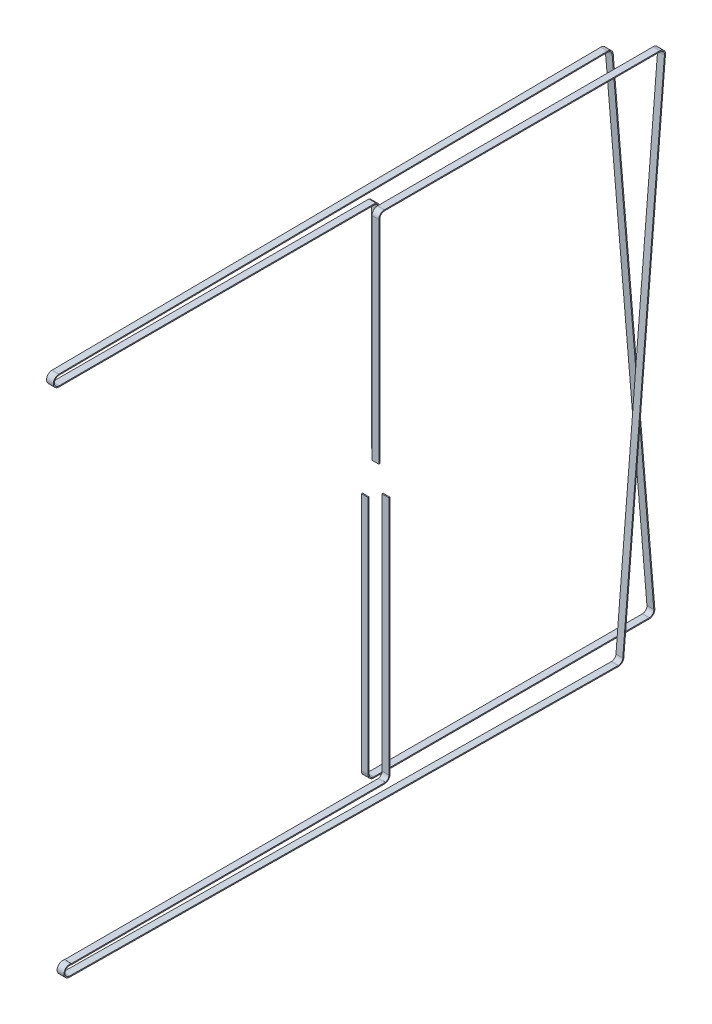
from build123d import *

# Parameters (mm, degrees)
EXTRUDE_START   = 1
EXTRUDE_1_DEPTH = 9
EXTRUDE_2_DEPTH = 9


with BuildPart() as part:
    # Эскиз1 → Вытянуть-Тонкостенный1 (new body)
    with BuildSketch(Plane(origin=(43, 0, 0), x_dir=(0, 0, -1), z_dir=(1, 0, 0)).offset(EXTRUDE_START)):
        with BuildLine():
            Line((-365.210954527, 391.088904873), (-365.210954527, 670))
            ThreePointArc((-365.210954527, 670), (-366.505742897, 674.181673224), (-369.937006136, 676.9))
            Line((-369.937006136, 676.9), (-787, 676.9))
            ThreePointArc((-787, 676.9), (-792.999927517, 682.870507794), (-787.0589837, 688.89971007))
            Line((-787.0589837, 688.89971007), (-64.860447413, 695.99971007))
            ThreePointArc((-64.860447413, 695.99971007), (-60.759896196, 694.434606184), (-58.822040574, 690.496486576))
            Line((-58.822040574, 690.496486576), (-4.020576861, 30.496486576))
            ThreePointArc((-4.020576861, 30.496486576), (-5.585313179, 25.936683587), (-10, 24))
            Line((-10, 24), (-372.610954527, 24))
            ThreePointArc((-372.610954527, 24), (-376.853595214, 25.757359313), (-378.610954527, 30))
            Line((-378.610954527, 30), (-378.610954527, 346.088904873))
            Line((-378.610954527, 346.088904873), (-380.010954527, 346.088904873))
            Line((-380.010954527, 346.088904873), (-380.010954527, 30))
            ThreePointArc((-380.010954527, 30), (-377.843544708, 24.767409819), (-372.610954527, 22.6))
            Line((-372.610954527, 22.6), (-10, 22.6))
            ThreePointArc((-10, 22.6), (-4.555219587, 24.988576424), (-2.625378128, 30.612333444))
            Line((-2.625378128, 30.612333444), (-57.426841842, 690.612333444))
            ThreePointArc((-57.426841842, 690.612333444), (-59.816863776, 695.469347626), (-64.874210276, 697.39964242))
            Line((-64.874210276, 697.39964242), (-787.072746563, 690.29964242))
            ThreePointArc((-787.072746563, 690.29964242), (-794.399910604, 682.863626279), (-787, 675.5))
            Line((-787, 675.5), (-370.213038765, 675.5))
            ThreePointArc((-370.213038765, 675.5), (-367.591617192, 673.287286528), (-366.610954527, 670))
            Line((-366.610954527, 670), (-366.610954527, 391.088904873))
            Line((-366.610954527, 391.088904873), (-365.210954527, 391.088904873))
        make_face()
    extrude(amount=EXTRUDE_1_DEPTH)


with BuildPart() as body_2:
    # Эскиз2 → Вытянуть-Тонкостенный2 (new body)
    with BuildSketch(Plane(origin=(57, 0, 0), x_dir=(0, 0, -1), z_dir=(1, 0, 0)).offset(EXTRUDE_START)):
        with BuildLine():
            Line((-365.210954527, 346.088904873), (-365.210954527, 30))
            ThreePointArc((-365.210954527, 30), (-366.937621008, 25.248864685), (-371.311842847, 22.714925612))
            Line((-371.311842847, 22.714925612), (-784.885145307, 22.714925612))
            ThreePointArc((-784.885145307, 22.714925612), (-792.897592042, 18.203815252), (-787.0589837, 11.10028993))
            Line((-787.0589837, 11.10028993), (-64.860447413, 4.00028993))
            ThreePointArc((-64.860447413, 4.00028993), (-60.759896196, 5.565393816), (-58.822040574, 9.503513424))
            Line((-58.822040574, 9.503513424), (-4.020576861, 669.503513424))
            ThreePointArc((-4.020576861, 669.503513424), (-5.585313179, 674.063316413), (-10, 676))
            Line((-10, 676), (-372.610954527, 676))
            ThreePointArc((-372.610954527, 676), (-376.853595214, 674.242640687), (-378.610954527, 670))
            Line((-378.610954527, 670), (-378.610954527, 391.088904873))
            Line((-378.610954527, 391.088904873), (-380.010954527, 391.088904873))
            Line((-380.010954527, 391.088904873), (-380.010954527, 670))
            ThreePointArc((-380.010954527, 670), (-377.843544708, 675.232590181), (-372.610954527, 677.4))
            Line((-372.610954527, 677.4), (-10, 677.4))
            ThreePointArc((-10, 677.4), (-4.555219587, 675.011423576), (-2.625378128, 669.387666556))
            Line((-2.625378128, 669.387666556), (-57.426841842, 9.387666556))
            ThreePointArc((-57.426841842, 9.387666556), (-59.816863776, 4.530652374), (-64.874210276, 2.60035758))
            Line((-64.874210276, 2.60035758), (-787.072746563, 9.70035758))
            ThreePointArc((-787.072746563, 9.70035758), (-794.297141528, 18.329522479), (-784.643982457, 24.114925612))
            Line((-784.643982457, 24.114925612), (-371.442237519, 24.114925612))
            ThreePointArc((-371.442237519, 24.114925612), (-367.973482045, 26.192921202), (-366.610954527, 30))
            Line((-366.610954527, 30), (-366.610954527, 346.088904873))
            Line((-366.610954527, 346.088904873), (-365.210954527, 346.088904873))
        make_face()
    extrude(amount=EXTRUDE_2_DEPTH)


solid = Compound([part.part, body_2.part])
